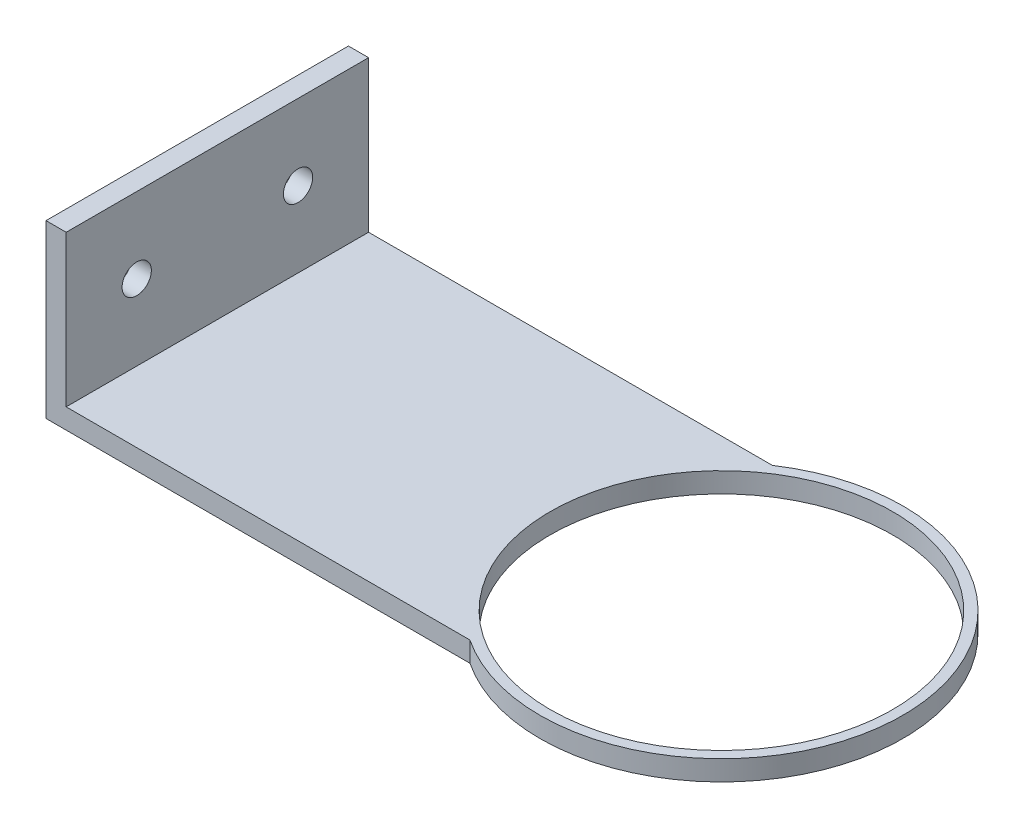
from build123d import *

# Parameters (mm, degrees)
SKETCH_1_R           = 18
EXTRUDE_1_DEPTH      = 2
SKETCH_2_W           = 2
SKETCH_2_H           = 30
EXTRUDE_2_DEPTH      = 15
HOLE_WIZARD_M3_5_1_D = 2.9
SKETCH_6_R           = 17
CUT_EXTRUDE_1_DEPTH  = 15


with BuildPart() as part:
    # 草图1 → 凸台-拉伸1 (new body)
    with BuildSketch(Plane(origin=(0, 0, 0), x_dir=(1, 0, 0), z_dir=(0, 1, 0))):
        Circle(SKETCH_1_R)
        with BuildLine():
            Line((-9.949874371, 15), (-52, 15))
            Line((-52, 15), (-52, -15))
            Line((-52, -15), (-9.949874371, -15))
            ThreePointArc((-9.949874371, -15), (-18, 0), (-9.949874371, 15))
        make_face()
    extrude(amount=EXTRUDE_1_DEPTH)

    # 草图2 → 凸台-拉伸2 (add)
    with BuildSketch(Plane(origin=(0, 2, 0), x_dir=(1, 0, 0), z_dir=(0, 1, 0))):
        with Locations((-51, 0)):
            Rectangle(SKETCH_2_W, SKETCH_2_H)
    extrude(amount=EXTRUDE_2_DEPTH)

    # M3.5 螺纹孔1 (through all)
    with Locations(Plane(origin=(-50, 0, 0), x_dir=(0, 0, -1), z_dir=(1, 0, 0))):
        with Locations((-8, 9.5), (8, 9.5)):
            Hole(HOLE_WIZARD_M3_5_1_D / 2)

    # 草图6 → 切除-拉伸1 (cut)
    with BuildSketch(Plane(origin=(0, 2, 0), x_dir=(1, 0, 0), z_dir=(0, 1, 0))):
        with Locations(Location((0, 0, 0), (0, 0, 270))):
            Circle(SKETCH_6_R)
    extrude(amount=-CUT_EXTRUDE_1_DEPTH, mode=Mode.SUBTRACT)


solid = part.part
